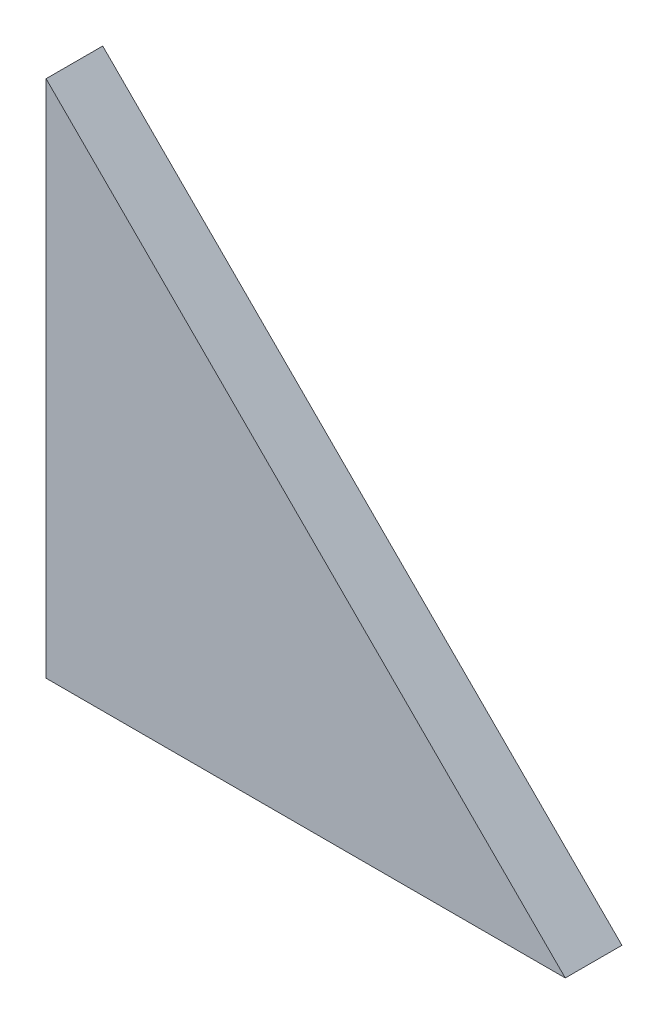
from build123d import *

# Parameters (mm, degrees)
EXTRUDE1_DEPTH = 12


with BuildPart() as part:
    # Sketch1 → Extrude1 (new body)
    with BuildSketch(Plane.XY):
        Polygon((0, 110), (110, 0), (0, 0), align=None)
    extrude(amount=EXTRUDE1_DEPTH)


solid = part.part
